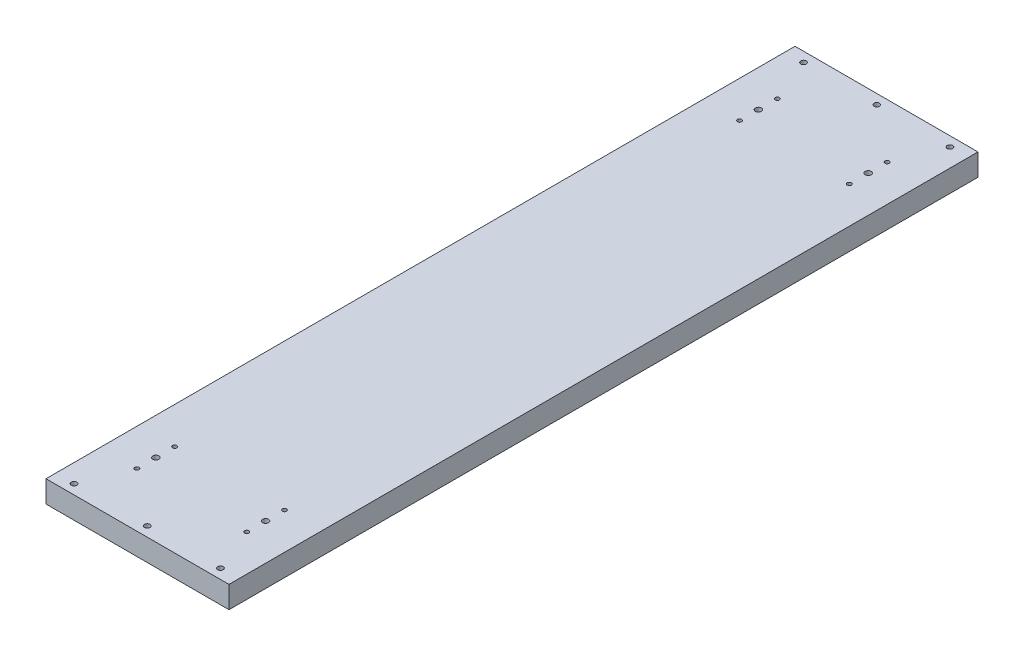
from build123d import *

# Parameters (mm, degrees)
SKETCH1_W                                         = 150
SKETCH1_H                                         = 614
BOSS_EXTRUDE1_DEPTH                               = 9
CSK_FOR_8_FLAT_HEAD_MACHINE_SCREW_100_D           = 4.4958
CSK_FOR_8_FLAT_HEAD_MACHINE_SCREW_100_CSINK_D     = 8.4328
CSK_FOR_8_FLAT_HEAD_MACHINE_SCREW_100_CSINK_ANGLE = 100
F_8_36_TAPPED_HOLE1_D                             = 3.4544
F_8_CLEARANCE_HOLE1_D                             = 4.9149
MIRROR2_AT_THE_SECOND_PLANE_COPY_1_D              = 3.4544
MIRROR2_AT_THE_SECOND_PLANE_COPY_2_D              = 4.9149


with BuildPart() as part:
    # Sketch1 → Boss-Extrude1 (new, symmetric)
    with BuildSketch(Plane(origin=(0, 0, 0), x_dir=(1, 0, 0), z_dir=(0, 1, 0))):
        Rectangle(SKETCH1_W, SKETCH1_H)
    extrude(amount=BOSS_EXTRUDE1_DEPTH, both=True)

    # CSK for #8 Flat Head Machine Screw (100)1 (through all)
    with Locations(Plane(origin=(-75, -9, 0), x_dir=(0, 0, -1), z_dir=(0, -1, 0))):
        with Locations((-299, 135), (-299, 75), (-299, 15)):
            csk_for_8_flat_head_machine_screw_100 = CounterSinkHole(CSK_FOR_8_FLAT_HEAD_MACHINE_SCREW_100_D / 2, CSK_FOR_8_FLAT_HEAD_MACHINE_SCREW_100_CSINK_D / 2, counter_sink_angle=CSK_FOR_8_FLAT_HEAD_MACHINE_SCREW_100_CSINK_ANGLE)

    # Mirror1: CSK for #8 Flat Head Machine Screw (100)1 across plane
    add(csk_for_8_flat_head_machine_screw_100.mirror(Plane.XY), mode=Mode.SUBTRACT)

    # #8-36 Tapped Hole1 (through all)
    with Locations(Plane(origin=(0, -9, 0), x_dir=(-1, 0, 0), z_dir=(0, -1, 0))):
        with Locations((45, -262.5), (45, -231.5)):
            f_8_36_tapped_hole1 = Hole(F_8_36_TAPPED_HOLE1_D / 2)

    # #8 Clearance Hole1 (through all)
    with Locations(Plane(origin=(0, -9, 0), x_dir=(-1, 0, 0), z_dir=(0, -1, 0))):
        with Locations((45, -247)):
            f_8_clearance_hole1 = Hole(F_8_CLEARANCE_HOLE1_D / 2)

    # Mirror2: #8-36 Tapped Hole1, #8 Clearance Hole1 across plane
    add(f_8_36_tapped_hole1.mirror(Plane.XY), mode=Mode.SUBTRACT)
    add(f_8_clearance_hole1.mirror(Plane.XY), mode=Mode.SUBTRACT)

    # Mirror2 at the second plane: #8-36 Tapped Hole1, #8 Clearance Hole1 across plane
    add(f_8_36_tapped_hole1.mirror(Plane(origin=(0, 0, 0), x_dir=(0, 0, 1), z_dir=(1, 0, 0))), mode=Mode.SUBTRACT)
    add(f_8_clearance_hole1.mirror(Plane(origin=(0, 0, 0), x_dir=(0, 0, 1), z_dir=(1, 0, 0))), mode=Mode.SUBTRACT)

    # Mirror2 at the second plane copy 1 (through all)
    with Locations(Plane.XZ.offset(9)):
        with Locations((45, -262.5), (45, -231.5)):
            Hole(MIRROR2_AT_THE_SECOND_PLANE_COPY_1_D / 2)

    # Mirror2 at the second plane copy 2 (through all)
    with Locations(Plane.XZ.offset(9)):
        with Locations((45, -247)):
            Hole(MIRROR2_AT_THE_SECOND_PLANE_COPY_2_D / 2)


solid = part.part
